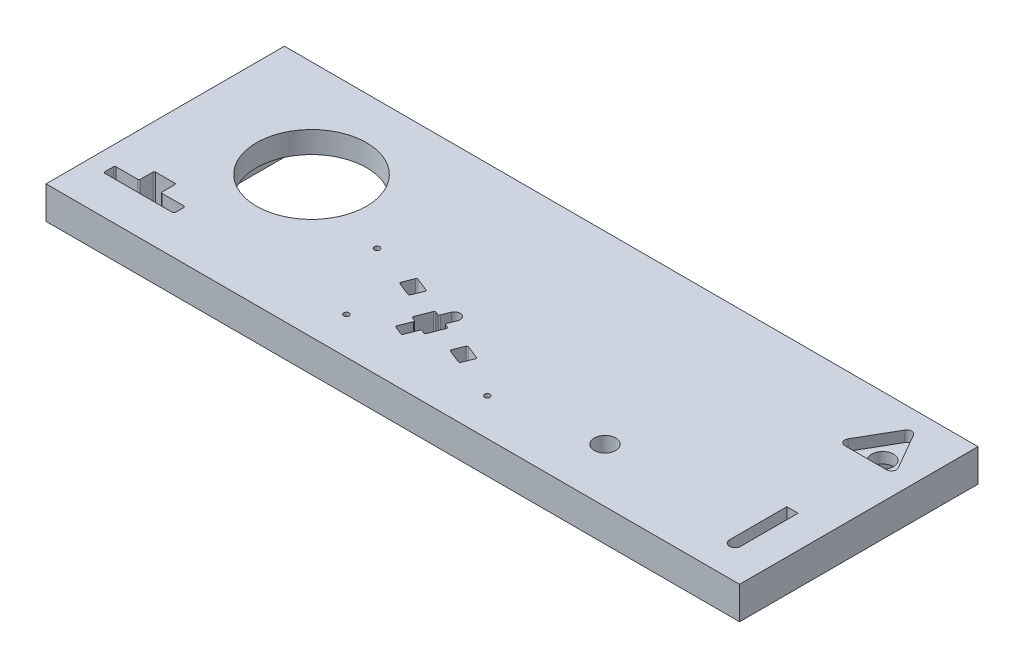
from build123d import *

# Parameters (mm, degrees)
BOSS_EXTRUDE1_DEPTH                 = 19.05
CUT_EXTRUDE1_DEPTH                  = 6.35
SKETCH4_R                           = 32.25800000000001
CUT_EXTRUDE2_DEPTH                  = 216.71315444358046
F_9_64_0_14063_DIAMETER_HOLE1_D     = 3.572002
F_9_64_0_14063_DIAMETER_HOLE1_DEPTH = 12.7
F_9_64_0_14063_DIAMETER_HOLE1_TIP   = 1.0731376664438417
CUT_EXTRUDE3_DEPTH                  = 6.35
CUT_EXTRUDE4_DEPTH                  = 216.24533095981434
CUT_EXTRUDE5_DEPTH                  = 6.35
SKETCH13_R                          = 6.318250000000138
CUT_EXTRUDE6_DEPTH                  = 216.71315444358046
CUT_EXTRUDE7_DEPTH                  = 6.35
SKETCH15_R                          = 6.381750000000044
CUT_EXTRUDE8_DEPTH                  = 216.24533095981434
CUT_EXTRUDE9_DEPTH                  = 6.35
SKETCH17_W                          = 22.711152241722402
SKETCH17_H                          = 33.33749999999997
CUT_EXTRUDE10_DEPTH                 = 6.35
CUT_EXTRUDE11_DEPTH                 = 216.71315444358046
CUT_EXTRUDE12_DEPTH                 = 6.35
CUT_EXTRUDE13_DEPTH                 = 216.24533095981434
F_1_8_0_125_DIAMETER_HOLE1_D        = 3.175
F_1_8_0_125_DIAMETER_HOLE1_DEPTH    = 11.1125
F_1_8_0_125_DIAMETER_HOLE1_TIP      = 0.9538662327062519
F_1_8_0_125_DIAMETER_HOLE2_D        = 3.175
FILLET1_R                           = 0.79375


with BuildPart() as part:
    # Sketch1 → Boss-Extrude1 (new body)
    with BuildSketch(Plane(origin=(0, 0, 0), x_dir=(1, 0, 0), z_dir=(0, 1, 0))):
        Polygon((-203.2, 69.85), (203.2, 69.85), (203.2, -69.85000000000002), (-203.2, -69.85), align=None)
    extrude(amount=BOSS_EXTRUDE1_DEPTH)

    # Sketch2 → Cut-Extrude1 (cut)
    with BuildSketch(Plane.XZ):
        Polygon((-140.49375, 56.67375000000003), (-119.85624999999999, 56.67375000000003), (-119.85624999999999, 26.193750000000026), (-94.45625, 26.193750000000026), (-94.45625, -51.59374999999998), (-165.89374999999998, -51.59374999999998), (-165.89374999999998, 26.193750000000026), (-140.49375, 26.193750000000026), align=None)
    extrude(amount=-CUT_EXTRUDE1_DEPTH, mode=Mode.SUBTRACT)

    # Sketch4 → Cut-Extrude2 (cut, through all)
    with BuildSketch(Plane(origin=(0, 19.05, 0), x_dir=(1, 0, 0), z_dir=(0, 1, 0))):
        with Locations(Location((-130.17499999999998, 12.699999999999974, 0), (0, 0, 270))):
            Circle(SKETCH4_R)
    extrude(amount=-CUT_EXTRUDE2_DEPTH, mode=Mode.SUBTRACT)

    # 9/64 (0.14063) Diameter Hole1
    with Locations(Plane(origin=(0, 0, 0), x_dir=(-1, 0, 0), z_dir=(0, -1, 0))):
        with Locations((159.54375, 42.06875), (100.80625, 42.06875), (100.80625, -16.66875), (159.54375, -16.66875)):
            Hole(F_9_64_0_14063_DIAMETER_HOLE1_D / 2, depth=F_9_64_0_14063_DIAMETER_HOLE1_DEPTH)
            with Locations((0, 0, -(F_9_64_0_14063_DIAMETER_HOLE1_DEPTH + F_9_64_0_14063_DIAMETER_HOLE1_TIP / 2))):  # 118° drill point
                Cone(0, F_9_64_0_14063_DIAMETER_HOLE1_D / 2, F_9_64_0_14063_DIAMETER_HOLE1_TIP, mode=Mode.SUBTRACT)

    # Sketch10 → Cut-Extrude3 (cut)
    with BuildSketch(Plane.XZ):
        Polygon((-181.81955, 59.53125), (-181.81955, 47.275749999999995), (-192.0875, 47.27574999999999), (-192.0875, 40.67174999999999), (-177.8381, 40.67174999999999), (-177.8381, 31.775399999999987), (-165.06189999999998, 31.775399999999987), (-165.06189999999998, 40.67174999999999), (-150.8125, 40.671749999999996), (-150.8125, 47.27574999999999), (-161.08044999999998, 47.275749999999995), (-161.08044999999998, 59.53125), align=None)
    extrude(amount=-CUT_EXTRUDE3_DEPTH, mode=Mode.SUBTRACT)

    # Sketch11 → Cut-Extrude4 (cut, through all)
    with BuildSketch(Plane.XZ.offset(-6.35)):
        Polygon((-192.0875, 47.27574999999999), (-150.8125, 47.27574999999999), (-150.8125, 40.671749999999996), (-165.06189999999998, 40.67174999999999), (-165.06189999999998, 31.775399999999987), (-177.8381, 31.775399999999987), (-177.8381, 40.67174999999999), (-192.0875, 40.67174999999999), align=None)
    extrude(amount=-CUT_EXTRUDE4_DEPTH, mode=Mode.SUBTRACT)

    # Sketch12 → Cut-Extrude5 (cut)
    with BuildSketch(Plane.XZ):
        Polygon((134.57176564278524, 36.00450000000002), (134.57176564278524, -25.84449999999997), (152.10790000000006, -25.84449999999997), (152.10790000000006, -48.29809999999997), (135.751582821393, -48.2981), (135.751582821393, -66.45909999999998), (92.88908282139299, -66.45909999999998), (92.88908282139299, -48.29809999999997), (51.09210000000004, -48.29809999999998), (51.09210000000004, -25.84449999999997), (68.62823435721486, -25.84449999999997), (68.62823435721486, 36.004500000000014), (51.09210000000004, 36.004500000000014), (51.09210000000004, 58.458100000000016), (93.29676564278526, 58.458100000000016), (93.29676564278526, 66.40830000000001), (134.57176564278524, 66.40830000000001), (134.57176564278524, 58.45810000000001), (152.10790000000006, 58.45810000000001), (152.10790000000006, 36.00450000000002), align=None)
    extrude(amount=-CUT_EXTRUDE5_DEPTH, mode=Mode.SUBTRACT)

    # Sketch13 → Cut-Extrude6 (cut, through all)
    with BuildSketch(Plane(origin=(0, 19.05, 0), x_dir=(1, 0, 0), z_dir=(0, 1, 0))):
        with Locations(Location((92.72013435721472, -38.227000000000004, 0), (0, 0, 270))):
            Circle(SKETCH13_R)
    extrude(amount=-CUT_EXTRUDE6_DEPTH, mode=Mode.SUBTRACT)

    # Sketch14 → Cut-Extrude7 (cut)
    with BuildSketch(Plane.XZ):
        with BuildLine():
            Line((169.51324999999997, -41.275), (169.51324999999997, -63.722249999999995))
            Line((169.51324999999997, -63.722249999999995), (182.27675000000008, -63.722249999999995))
            Line((182.27675000000008, -63.722249999999995), (182.27675000000008, -41.275))
            ThreePointArc((182.27675000000008, -41.275), (175.895, -34.89324999999993), (169.51324999999997, -41.275))
        make_face()
    extrude(amount=-CUT_EXTRUDE7_DEPTH, mode=Mode.SUBTRACT)

    # Sketch15 → Cut-Extrude8 (cut, through all)
    with BuildSketch(Plane.XZ.offset(-6.35)):
        with Locations(Location((175.895, -41.275, 0), (0, 0, 270))):
            Circle(SKETCH15_R)
    extrude(amount=-CUT_EXTRUDE8_DEPTH, mode=Mode.SUBTRACT)

    # Sketch16 → Cut-Extrude9 (cut)
    with BuildSketch(Plane(origin=(0, 19.05, 0), x_dir=(1, 0, 0), z_dir=(0, 1, 0))):
        with BuildLine():
            Line((173.35500000000127, 56.82255052709672), (161.1604262769128, 35.70092926206313))
            ThreePointArc((161.1604262769128, 35.70092926206313), (161.1604262769128, 32.767989894579955), (163.7004262769127, 31.30152021083836))
            Line((163.7004262769127, 31.30152021083836), (188.08957372308961, 31.30152021083836))
            ThreePointArc((188.08957372308961, 31.30152021083836), (190.62957372308952, 32.76798989457995), (190.62957372308952, 35.70092926206313))
            Line((190.62957372308952, 35.70092926206313), (178.43500000000105, 56.82255052709672))
            ThreePointArc((178.43500000000105, 56.82255052709672), (175.89500000000118, 58.289020210838295), (173.35500000000127, 56.82255052709672))
        make_face()
    extrude(amount=-CUT_EXTRUDE9_DEPTH, mode=Mode.SUBTRACT)

    # Sketch17 → Cut-Extrude10 (cut)
    with BuildSketch(Plane.XZ):
        with Locations((175.66182612086118, -4.1567e-13)):
            Rectangle(SKETCH17_W, SKETCH17_H)
    extrude(amount=-CUT_EXTRUDE10_DEPTH, mode=Mode.SUBTRACT)

    # Sketch18 → Cut-Extrude11 (cut, through all)
    with BuildSketch(Plane.XZ):
        with BuildLine():
            Line((184.2770000000001, 16.66874999999957), (177.67300000000012, 16.66874999999957))
            Line((177.67300000000012, 16.66874999999957), (177.67300000000014, 50.22849999999955))
            ThreePointArc((177.67300000000014, 50.22849999999955), (180.9750000000001, 53.53049999999951), (184.27700000000007, 50.22849999999955))
            Line((184.27700000000007, 50.22849999999955), (184.2770000000001, 16.66874999999957))
        make_face()
    extrude(amount=-CUT_EXTRUDE11_DEPTH, mode=Mode.SUBTRACT)

    # Sketch19 → Cut-Extrude12 (cut)
    with BuildSketch(Plane.XZ):
        Polygon((-38.53885006710374, -14.533160243737765), (-18.348744602841368, -6.516703634707988), (-7.884471424400047, -32.87183650495906), (6.067416712845286, -27.332256433709006), (-4.396856465596039, -0.9771235634579329), (21.95474274455676, 9.485746579575835), (7.973693028031891, 44.698170477657065), (-19.174651063054725, 33.918953756950515), (-22.479129727482277, 42.24155512474755), (-28.67603435696945, 39.78108174284713), (-25.37155569254192, 31.458480375050147), (-52.51989978362863, 20.6792636543435), align=None)
    extrude(amount=-CUT_EXTRUDE12_DEPTH, mode=Mode.SUBTRACT)

    # Sketch21 → Cut-Extrude13 (cut, through all)
    with BuildSketch(Plane.XZ.offset(-6.35)):
        with BuildLine():
            Line((-28.676034356969414, 39.781081742847014), (-22.479129727482224, 42.24155512474745))
            Line((-22.479129727482224, 42.24155512474745), (-19.174651063054778, 33.91895375695053))
            Line((-19.174651063054778, 33.91895375695053), (-16.076198748311207, 35.14919044790074))
            Line((-16.076198748311207, 35.14919044790074), (-12.159930286646826, 25.285746145301644))
            Line((-12.159930286646826, 25.285746145301644), (-15.28789167105462, 24.043792914437688))
            Line((-15.28789167105462, 24.043792914437688), (-13.1734227082819, 18.718328879467087))
            ThreePointArc((-13.1734227082819, 18.718328879467087), (-15.023845802324871, 14.430865483351289), (-19.311309198440615, 16.281288577394285))
            Line((-19.311309198440615, 16.281288577394285), (-21.425778161213334, 21.606752612364886))
            Line((-21.425778161213334, 21.606752612364886), (-24.553739545621138, 20.364799381500816))
            Line((-24.553739545621138, 20.364799381500816), (-28.470008007285482, 30.228243684099905))
            Line((-28.470008007285482, 30.228243684099905), (-25.371555692541914, 31.45848037505011))
            Line((-25.371555692541914, 31.45848037505011), (-28.676034356969414, 39.781081742847014))
        make_face()
        Polygon((8.690196526212633, 39.66718899113594), (11.689630744148396, 32.11286715709442), (2.5123100785745462, 28.46902324389903), (-0.4871241393612164, 36.02334507794055), align=None)
        Polygon((-37.41346117712153, 12.616544740511934), (-40.4128953950573, 20.17086657455345), (-49.59021606063114, 16.52702266135806), (-46.590781842695385, 8.972700827316546), align=None)
    extrude(amount=-CUT_EXTRUDE13_DEPTH, mode=Mode.SUBTRACT)

    # 1/8 (0.125) Diameter Hole1
    with Locations(Plane(origin=(0, 0, 0), x_dir=(-1, 0, 0), z_dir=(0, -1, 0))):
        with Locations((31.573223572, -20.182550025), (33.248106656, -1.480475009), (-7.120300645, -17.508701611), (176.18075, -53.6575), (166.71925, -53.6575), (-57.790497441, -52.1081), (-145.409502559, -52.1081), (-145.409502559, 41.9481), (-57.790497441, 41.9481), (-175.895, 56.5785), (-170.434, -6.2103), (-170.434, 6.2103)):
            Hole(F_1_8_0_125_DIAMETER_HOLE1_D / 2, depth=F_1_8_0_125_DIAMETER_HOLE1_DEPTH)
            with Locations((0, 0, -(F_1_8_0_125_DIAMETER_HOLE1_DEPTH + F_1_8_0_125_DIAMETER_HOLE1_TIP / 2))):  # 118° drill point
                Cone(0, F_1_8_0_125_DIAMETER_HOLE1_D / 2, F_1_8_0_125_DIAMETER_HOLE1_TIP, mode=Mode.SUBTRACT)

    # 1/8 (0.125) Diameter Hole2 (through all)
    with Locations(Plane(origin=(0, 19.05, 0), x_dir=(1, 0, 0), z_dir=(0, 1, 0))):
        with Locations((-73.501249863, -5.576708848), (-48.949694582, -48.10125), (33.600305418, -48.10125)):
            Hole(F_1_8_0_125_DIAMETER_HOLE2_D / 2)

    # Fillet1
    fillet1_edges = [part.edges().sort_by_distance(p)[0] for p in [
        (152.10790000000006, 3.175, 36.00450000000002),
        (134.57176564278524, 3.175, 36.00450000000002),
        (134.57176564278524, 3.175, -25.84449999999997),
        (152.10790000000006, 3.175, -25.84449999999997),
        (152.10790000000006, 3.175, -48.29809999999997),
        (135.751582821393, 3.175, -48.2981),
        (135.751582821393, 3.175, -66.45909999999998),
        (92.88908282139299, 3.175, -66.45909999999998),
        (92.88908282139299, 3.175, -48.29809999999997),
        (51.09210000000004, 3.175, -48.29809999999998),
        (51.09210000000004, 3.175, -25.84449999999997),
        (68.62823435721486, 3.175, -25.84449999999997),
        (68.62823435721486, 3.175, 36.004500000000014),
        (51.09210000000004, 3.175, 36.004500000000014),
        (51.09210000000004, 3.175, 58.458100000000016),
        (93.29676564278526, 3.175, 58.458100000000016),
        (93.29676564278526, 3.175, 66.40830000000001),
        (134.57176564278524, 3.175, 66.40830000000001),
        (134.57176564278524, 3.175, 58.45810000000001),
        (152.10790000000006, 3.175, 58.45810000000001),
        (-94.45625, 3.175, -51.59374999999998),
        (-165.89374999999998, 3.175, -51.59374999999998),
        (-165.89374999999998, 3.175, 26.193750000000026),
        (-140.49375, 3.175, 26.193750000000026),
        (-140.49375, 3.175, 56.67375000000003),
        (182.27675000000008, 3.175, -63.722249999999995),
        (-119.85624999999999, 3.175, 56.67375000000003),
        (169.51324999999997, 3.175, -63.722249999999995),
        (-119.85624999999999, 3.175, 26.193750000000026),
        (-94.45625, 3.175, 26.193750000000026),
        (164.30624999999998, 3.175, 16.66874999999957),
        (187.01740224172238, 3.175, 16.66874999999957),
        (187.01740224172238, 3.175, -16.6687500000004),
        (164.30624999999998, 3.175, -16.6687500000004),
        (-38.53885006710374, 3.175, -14.533160243737765),
        (-52.51989978362863, 3.175, 20.6792636543435),
        (-25.371555692541918, 9.525, 31.45848037505013),
        (-28.67603435696943, 9.525, 39.78108174284707),
        (-22.479129727482253, 9.525, 42.2415551247475),
        (-19.174651063054753, 9.525, 33.91895375695052),
        (7.973693028031891, 3.175, 44.698170477657065),
        (21.95474274455676, 3.175, 9.485746579575835),
        (-4.396856465596039, 3.175, -0.9771235634579329),
        (6.067416712845286, 3.175, -27.332256433709006),
        (-7.884471424400047, 3.175, -32.87183650495906),
        (-18.348744602841368, 3.175, -6.516703634707988),
        (-37.41346117712153, 12.7, 12.616544740511934),
        (-46.590781842695385, 12.7, 8.972700827316546),
        (-49.59021606063114, 12.7, 16.52702266135806),
        (-40.4128953950573, 12.7, 20.17086657455345),
        (-0.4871241393612164, 12.7, 36.02334507794055),
        (8.690196526212633, 12.7, 39.66718899113594),
        (11.689630744148396, 12.7, 32.11286715709442),
        (2.5123100785745462, 12.7, 28.46902324389903),
        (-16.076198748311207, 12.7, 35.14919044790074),
        (-12.159930286646826, 12.7, 25.285746145301644),
        (-15.28789167105462, 12.7, 24.043792914437688),
        (-21.425778161213334, 12.7, 21.606752612364886),
        (-24.553739545621138, 12.7, 20.364799381500816),
        (-28.470008007285482, 12.7, 30.228243684099905),
        (-181.81955, 3.175, 59.53125),
        (-161.08044999999998, 3.175, 59.53125),
        (-150.8125, 9.525, 47.27574999999999),
        (-150.8125, 9.525, 40.671749999999996),
        (-165.06189999999998, 9.525, 40.67174999999999),
        (-165.06189999999998, 9.525, 31.775399999999987),
        (-177.8381, 9.525, 31.775399999999987),
        (-177.8381, 9.525, 40.67174999999999),
        (-192.0875, 9.525, 40.67174999999999),
        (-192.0875, 9.525, 47.27574999999999),
    ]]
    fillet(fillet1_edges, radius=FILLET1_R)


solid = part.part
